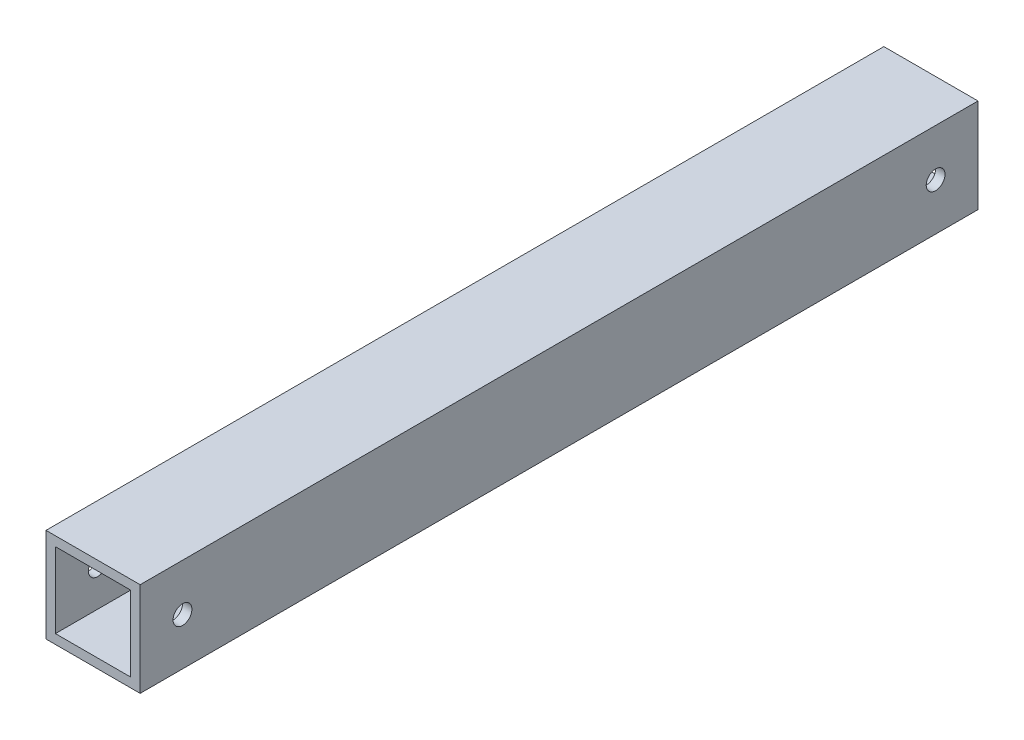
from build123d import *

# Parameters (mm, degrees)
SKETCH_1_W          = 20
SKETCH_1_H          = 20
SKETCH_1_W_2        = 16
SKETCH_1_H_2        = 16
EXTRUDE_1_DEPTH     = 90
SKETCH_2_R          = 2
CUT_EXTRUDE_1_DEPTH = 93.736184955
CUT_EXTRUDE_2_DEPTH = 93.736184955


with BuildPart() as part:
    # 草图1 → 凸台-拉伸1 (new, symmetric)
    with BuildSketch(Plane.XY):
        Rectangle(SKETCH_1_W, SKETCH_1_H)
        Rectangle(SKETCH_1_W_2, SKETCH_1_H_2, mode=Mode.SUBTRACT)
    extrude(amount=EXTRUDE_1_DEPTH, both=True)

    # 草图2 → 切除-拉伸1 (cut, through all)
    with BuildSketch(Plane(origin=(10, 0, 0), x_dir=(0, 0, -1), z_dir=(1, 0, 0))):
        with Locations(Location((80, 0, 0), (0, 0, 90))):
            Circle(SKETCH_2_R)
        with Locations(Location((-80, 0, 0), (0, 0, 90))):
            Circle(SKETCH_2_R)
    extrude(amount=-CUT_EXTRUDE_1_DEPTH, mode=Mode.SUBTRACT)

    # 草图3 → 切除-拉伸2 (cut, through all)
    with BuildSketch(Plane(origin=(10, 0, 0), x_dir=(0, 0, -1), z_dir=(1, 0, 0))):
        Polygon((-90, 10), (-89, 10), (-89, -15.299098046), (-95.501418201, -15.299098046), (-95.501418201, 10), align=None)
        Polygon((89, -15.299098046), (95.501418201, -15.299098046), (95.501418201, 10), (90, 10), (89, 10), align=None)
    extrude(amount=-CUT_EXTRUDE_2_DEPTH, mode=Mode.SUBTRACT)


solid = part.part
